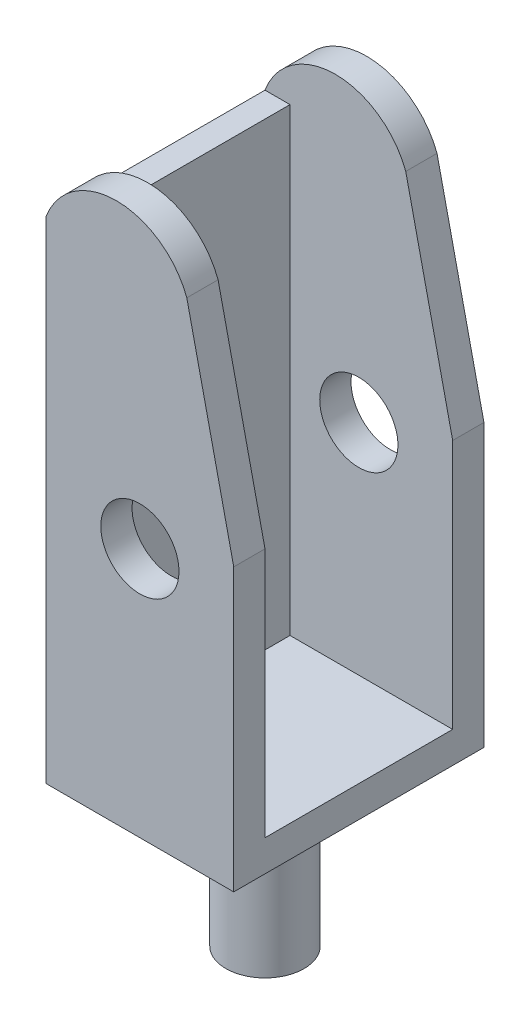
from build123d import *

# Parameters (mm, degrees)
BOSS_EXTRUDE1_DEPTH = 10
SKETCH4_W           = 60
SKETCH4_H           = 60
BOSS_EXTRUDE2_DEPTH = 10
SKETCH5_W           = 60
SKETCH5_H           = 147
BOSS_EXTRUDE3_DEPTH = 8
SKETCH6_R           = 12.5
CUT_EXTRUDE1_DEPTH  = 72
SKETCH7_R           = 12.5
BOSS_EXTRUDE4_DEPTH = 50


with BuildPart() as part:
    # Sketch2 → Boss-Extrude1 (new body)
    with BuildSketch(Plane.XY.offset(30)):
        with BuildLine():
            Line((0, -80), (30, -80))
            Line((30, -80), (30, 10))
            Line((30, 10), (15, 77))
            ThreePointArc((15, 77), (-7.5, 92.648353456), (-30, 77))
            Line((-30, 77), (-30, -80))
            Line((-30, -80), (0, -80))
        make_face()
    boss_extrude1 = extrude(amount=BOSS_EXTRUDE1_DEPTH)

    # Sketch4 → Boss-Extrude2 (add)
    with BuildSketch(Plane.XZ.offset(80)):
        Rectangle(SKETCH4_W, SKETCH4_H)
    extrude(amount=-BOSS_EXTRUDE2_DEPTH)

    # Mirror3: Boss-Extrude1 across plane
    add(boss_extrude1.mirror(Plane.XY))

    # Sketch5 → Boss-Extrude3 (add)
    with BuildSketch(Plane.ZY.offset(30)):
        with Locations((0, 3.5)):
            Rectangle(SKETCH5_W, SKETCH5_H)
    extrude(amount=-BOSS_EXTRUDE3_DEPTH)

    # Sketch6 → Cut-Extrude1 (cut, symmetric)
    with BuildSketch(Plane.XY):
        Circle(SKETCH6_R)
    extrude(amount=CUT_EXTRUDE1_DEPTH, both=True, mode=Mode.SUBTRACT)

    # Sketch7 → Boss-Extrude4 (add)
    with BuildSketch(Plane.XZ.offset(80)):
        Circle(SKETCH7_R)
    extrude(amount=BOSS_EXTRUDE4_DEPTH)


solid = part.part
